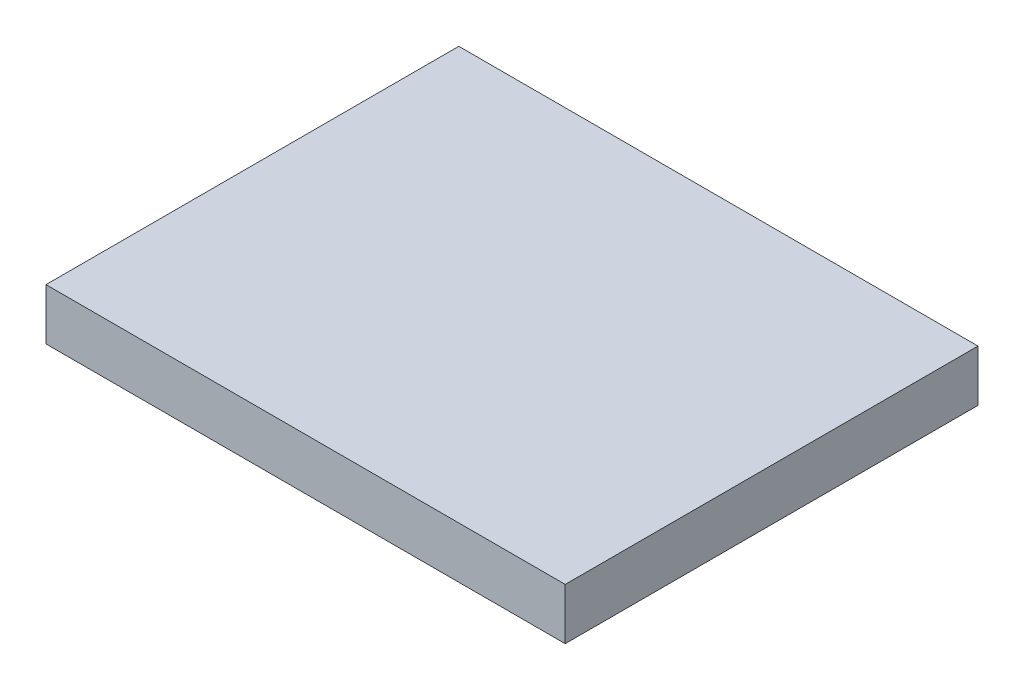
from build123d import *

# Parameters (mm, degrees)
SKETCH1_W           = 283
SKETCH1_H           = 225
BOSS_EXTRUDE1_DEPTH = 28


with BuildPart() as part:
    # Sketch1 → Boss-Extrude1 (new body)
    with BuildSketch(Plane(origin=(0, 0, 0), x_dir=(1, 0, 0), z_dir=(0, 1, 0))):
        with Locations((141.5, 112.5)):
            Rectangle(SKETCH1_W, SKETCH1_H)
    extrude(amount=BOSS_EXTRUDE1_DEPTH)


solid = part.part
